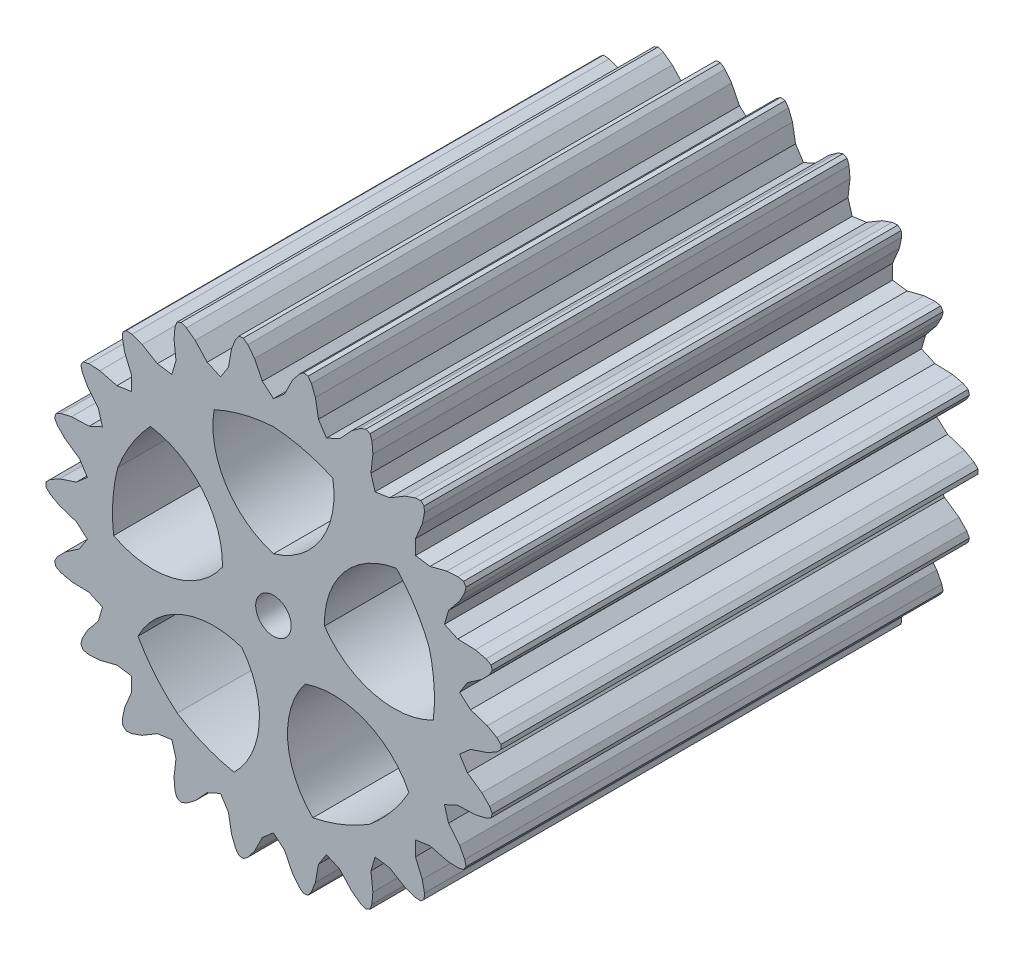
from build123d import *

# Parameters (mm, degrees)
SKETCH1_R               = 20.5
BOSS_EXTRUDE1_DEPTH     = 43
CUT_EXTRUDE1_DEPTH      = 52.860389509
CUT_EXTRUDE2_DEPTH      = 52.860389509
CUT_EXTRUDE2_DEPTH_BACK = 52.860389509
SKETCH4_R               = 1.6
CIRPATTERN1_COUNT       = 22
CUT_EXTRUDE4_DEPTH      = 52.789252598
CIRPATTERN2_COUNT       = 5


with BuildPart() as part:
    # Sketch1 → Boss-Extrude1 (new body)
    with BuildSketch(Plane.XY):
        Circle(SKETCH1_R)
    extrude(amount=BOSS_EXTRUDE1_DEPTH)

    # Sketch2 → Cut-Extrude1 (cut, through all)
    with BuildSketch(Plane.XY):
        Polygon((0, 16.944693036), (-0.998470792, 17.804120424), (-1.704297747, 19.225185361), (-2.306603416, 20.006300526), (-2.715384942, 20.31936723), (0, 24.503722989), (2.715384942, 20.31936723), (2.306603416, 20.006300526), (1.704297747, 19.225185361), (0.998470792, 17.804120424), align=None)
    cut_extrude1 = extrude(amount=CUT_EXTRUDE1_DEPTH, mode=Mode.SUBTRACT)

    # Sketch4 → Cut-Extrude2 (cut, two sides: drawn at the far end of the back side and taken through both)
    with BuildSketch(Plane.XY.offset(43).offset(-CUT_EXTRUDE2_DEPTH_BACK)):
        Circle(SKETCH4_R)
    extrude(amount=CUT_EXTRUDE2_DEPTH + CUT_EXTRUDE2_DEPTH_BACK, mode=Mode.SUBTRACT)

    # CirPattern1: Cut-Extrude1 ×22 about axis
    cirpattern1_axis = Axis((0, 0, 0), (0, 0, 1))
    for i in range(1, CIRPATTERN1_COUNT):
        add(cut_extrude1.rotate(cirpattern1_axis, i * 360 / CIRPATTERN1_COUNT), mode=Mode.SUBTRACT)

    # Sketch5 → Cut-Extrude4 (cut, symmetric)
    with BuildSketch(Plane.XY):
        with BuildLine():
            ThreePointArc((0, 4.833898347), (-4.302891662, 8.105605948), (-5.351816027, 13.408313271))
            ThreePointArc((-5.351816027, 13.408313271), (-2.737876625, 14.32777489), (0, 14.754530622))
            ThreePointArc((0, 14.754530622), (2.737876625, 14.32777489), (5.351816027, 13.408313271))
            ThreePointArc((5.351816027, 13.408313271), (4.302891662, 8.105605948), (0, 4.833898347))
        make_face()
    cut_extrude4 = extrude(amount=CUT_EXTRUDE4_DEPTH, both=True, mode=Mode.SUBTRACT)

    # CirPattern2: Cut-Extrude4 ×5 about axis
    cirpattern2_axis = Axis((0, 0, 0), (0, 0, 1))
    for i in range(1, CIRPATTERN2_COUNT):
        add(cut_extrude4.rotate(cirpattern2_axis, i * 360 / CIRPATTERN2_COUNT), mode=Mode.SUBTRACT)


solid = part.part
